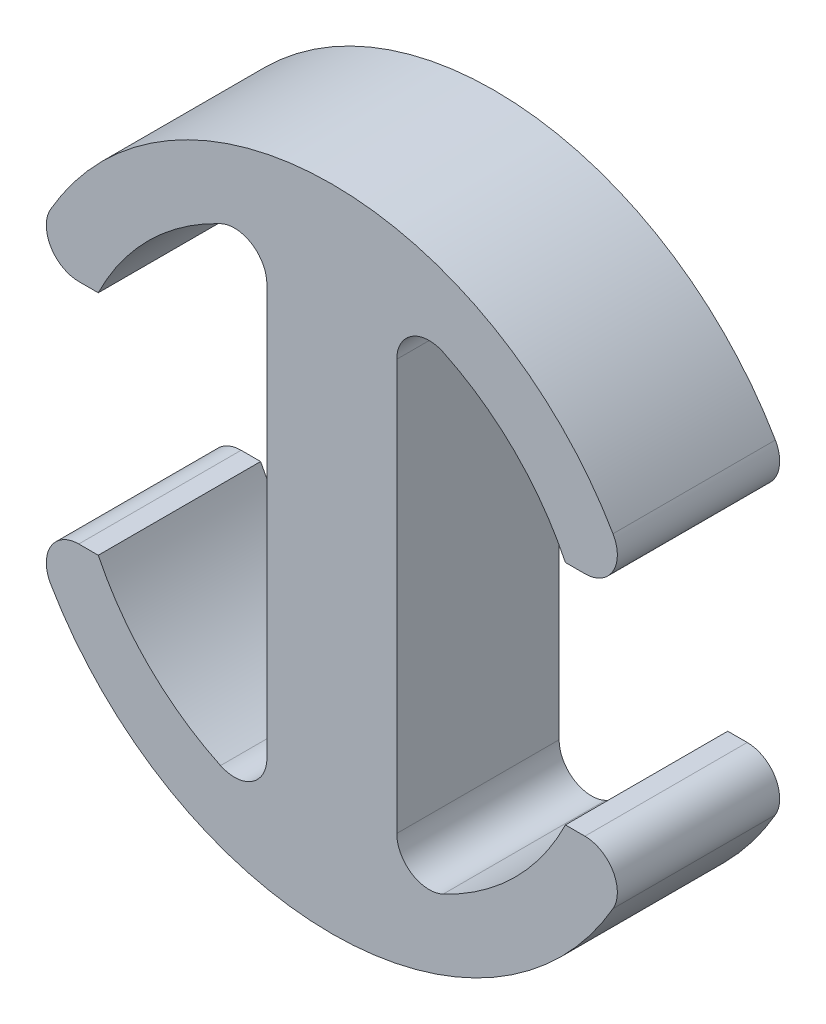
from build123d import *

# Parameters (mm, degrees)
BOSS_EXTRUDE1_DEPTH = 5


with BuildPart() as part:
    # Sketch1 → Boss-Extrude1 (new body)
    with BuildSketch(Plane.XY):
        with BuildLine():
            Line((-2, -6.32455532), (-2, 6.32455532))
            ThreePointArc((-2, 6.32455532), (-2.465477516, 7.169709575), (-3.428571429, 7.228063223))
            ThreePointArc((-3.428571429, 7.228063223), (-5.628767855, 5.684801882), (-7.193747285, 3.5))
            Line((-7.193747285, 3.5), (-7.794228634, 3.5))
            ThreePointArc((-7.794228634, 3.5), (-8.660254038, 4), (-8.660254038, 5))
            ThreePointArc((-8.660254038, 5), (0, 10), (8.660254038, 5))
            ThreePointArc((8.660254038, 5), (8.660254038, 4), (7.794228634, 3.5))
            Line((7.794228634, 3.5), (7.193747285, 3.5))
            ThreePointArc((7.193747285, 3.5), (5.628767855, 5.684801882), (3.428571429, 7.228063223))
            ThreePointArc((3.428571429, 7.228063223), (2.465477516, 7.169709575), (2, 6.32455532))
            Line((2, 6.32455532), (2, -6.32455532))
            ThreePointArc((2, -6.32455532), (2.465477516, -7.169709575), (3.428571429, -7.228063223))
            ThreePointArc((3.428571429, -7.228063223), (5.628767855, -5.684801882), (7.193747285, -3.5))
            Line((7.193747285, -3.5), (7.794228634, -3.5))
            ThreePointArc((7.794228634, -3.5), (8.660254038, -4), (8.660254038, -5))
            ThreePointArc((8.660254038, -5), (0, -10), (-8.660254038, -5))
            ThreePointArc((-8.660254038, -5), (-8.660254038, -4), (-7.794228634, -3.5))
            Line((-7.794228634, -3.5), (-7.193747285, -3.5))
            ThreePointArc((-7.193747285, -3.5), (-5.628767855, -5.684801882), (-3.428571429, -7.228063223))
            ThreePointArc((-3.428571429, -7.228063223), (-2.465477516, -7.169709575), (-2, -6.32455532))
        make_face()
    extrude(amount=BOSS_EXTRUDE1_DEPTH)


solid = part.part
